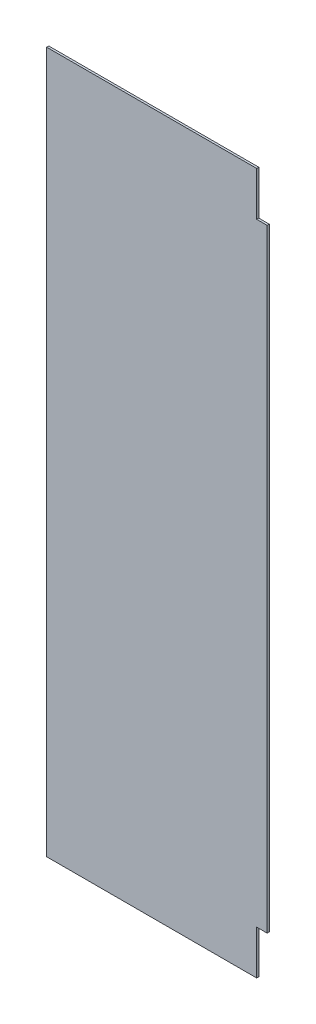
from build123d import *

# Parameters (mm, degrees)
EXTRUDE_1_DEPTH = 0.1


with BuildPart() as part:
    # Эскиз1 → Бобышка-Вытянуть1 (new body)
    with BuildSketch(Plane.XY):
        Polygon((23.4, 14.6), (23.9, 14.6), (23.9, -14.6), (23.4, -14.6), (23.4, -16.7), (13.4, -16.7), (13.4, 16.7), (23.4, 16.7), align=None)
    extrude(amount=EXTRUDE_1_DEPTH)


solid = part.part
